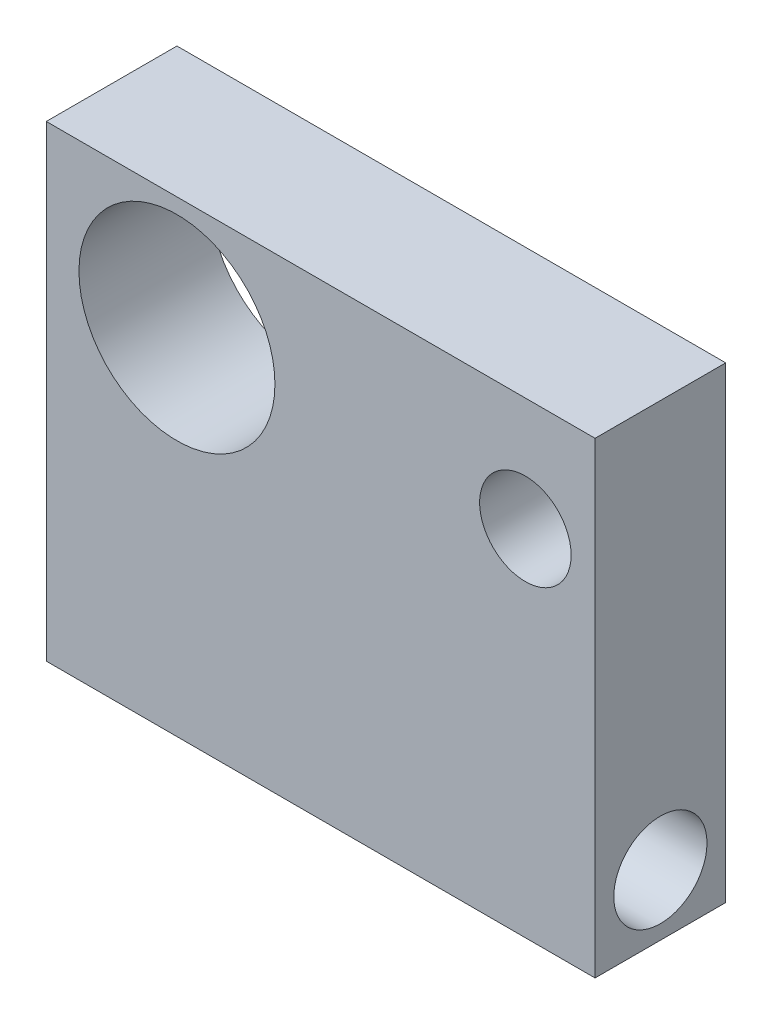
from build123d import *

# Parameters (mm, degrees)
SKETCH2_W           = 63
SKETCH2_H           = 53.66
SKETCH2_R           = 5.25
SKETCH2_R_2         = 11.25
BOSS_EXTRUDE1_DEPTH = 15
SKETCH3_R           = 5.35
CUT_EXTRUDE1_DEPTH  = 71.244392635


with BuildPart() as part:
    # Sketch2 → Boss-Extrude1 (new body)
    with BuildSketch(Plane.XY):
        with Locations((-0.443782019, -0.377989574)):
            Rectangle(SKETCH2_W, SKETCH2_H)
        with Locations((23.056217981, 13.452010426)):
            Circle(SKETCH2_R, mode=Mode.SUBTRACT)
        with Locations((-16.943782019, 13.452010426)):
            Circle(SKETCH2_R_2, mode=Mode.SUBTRACT)
    extrude(amount=BOSS_EXTRUDE1_DEPTH)

    # Sketch3 → Cut-Extrude1 (cut, through all)
    with BuildSketch(Plane(origin=(31.056217981, 0, 0), x_dir=(0, 0, -1), z_dir=(1, 0, 0))):
        with Locations((-7.5, -20.207989574)):
            Circle(SKETCH3_R)
    extrude(amount=-CUT_EXTRUDE1_DEPTH, mode=Mode.SUBTRACT)


solid = part.part
